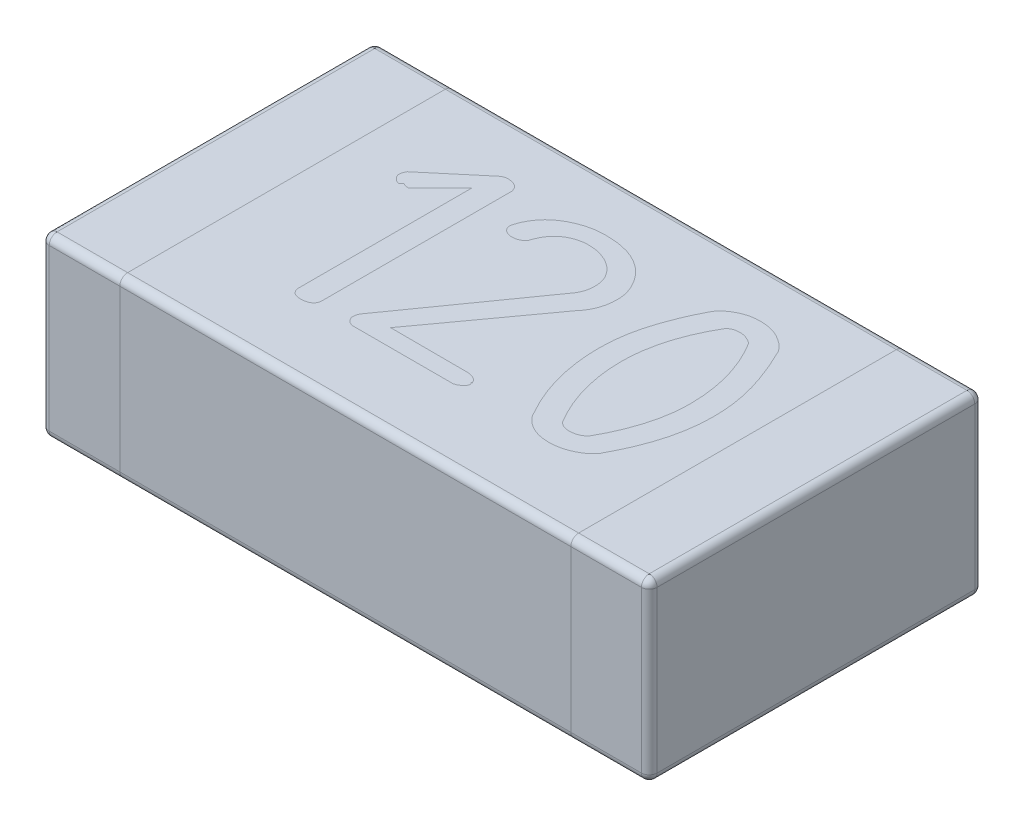
from build123d import *

# Parameters (mm, degrees)
BOSS_EXTRUDE1_DEPTH = 0.225
FILLET2_R           = 0.02


with BuildPart() as part:
    # Sketch1 → Boss-Extrude1 (new, symmetric)
    with BuildSketch(Plane(origin=(0, 0, 0), x_dir=(1, 0, 0), z_dir=(0, 1, 0))):
        with BuildLine():
            Line((-0.755, -0.425), (0.755, -0.425))
            ThreePointArc((0.755, -0.425), (0.769142136, -0.419142136), (0.775, -0.405))
            Line((0.775, -0.405), (0.775, 0.405))
            ThreePointArc((0.775, 0.405), (0.769142136, 0.419142136), (0.755, 0.425))
            Line((0.755, 0.425), (-0.755, 0.425))
            ThreePointArc((-0.755, 0.425), (-0.769142136, 0.419142136), (-0.775, 0.405))
            Line((-0.775, 0.405), (-0.775, -0.405))
            ThreePointArc((-0.775, -0.405), (-0.769142136, -0.419142136), (-0.755, -0.425))
        make_face()
    extrude(amount=BOSS_EXTRUDE1_DEPTH, both=True)

    # Fillet2
    fillet2_edges = [part.edges().sort_by_distance(p)[0] for p in [
        (0.769142136, 0.225, 0.419142136),
        (0, -0.225, 0.425),
        (0, -0.225, 0.425),
        (0, -0.225, 0.425),
        (-0.769142136, -0.225, 0.419142136),
        (0, -0.225, -0.425),
        (0, -0.225, -0.425),
        (0.775, 0.225, 0),
        (0.769142136, 0.225, -0.419142136),
        (0, 0.225, -0.425),
        (-0.769142136, 0.225, -0.419142136),
        (-0.775, 0.225, 0),
        (-0.769142136, 0.225, 0.419142136),
        (0, 0.225, 0.425),
        (-0.775, -0.225, 0),
        (0, 0.225, 0.425),
        (0, 0.225, -0.425),
        (-0.769142136, -0.225, -0.419142136),
        (0, 0.225, -0.425),
        (0, 0.225, 0.425),
        (0, -0.225, -0.425),
        (0.769142136, -0.225, -0.419142136),
        (0.775, -0.225, 0),
        (0.769142136, -0.225, 0.419142136),
    ]]
    fillet(fillet2_edges, radius=FILLET2_R)


solid = part.part
